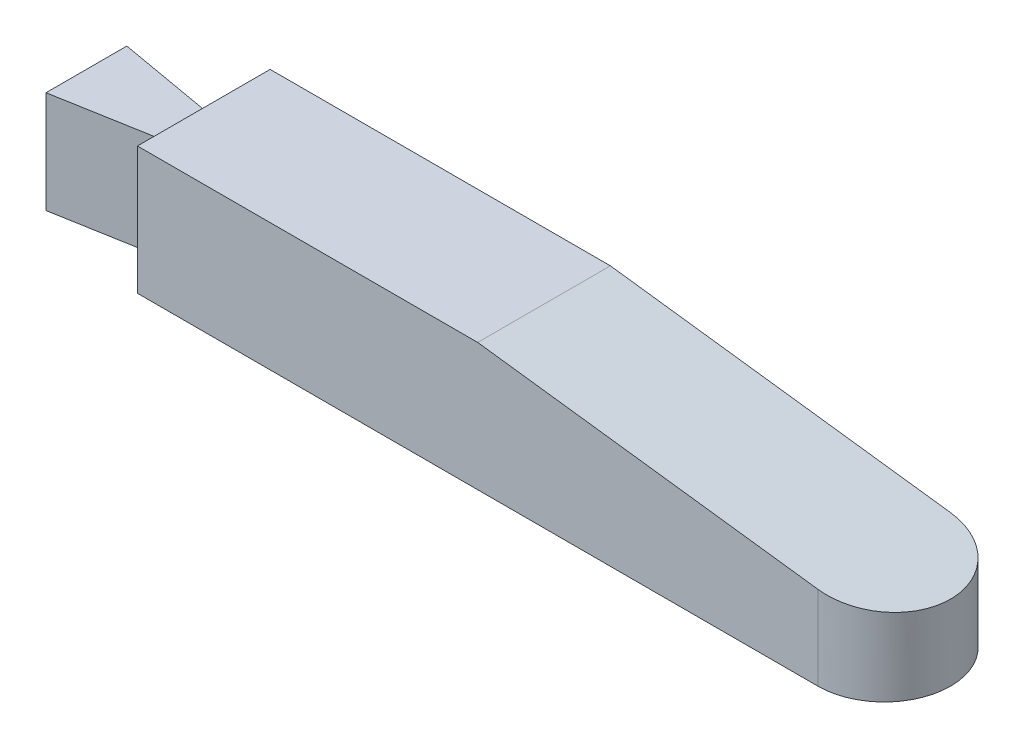
from build123d import *

# Parameters (mm, degrees)
BOSS_EXTRUDE1_DEPTH = 38.1
CUT_EXTRUDE1_DEPTH  = 7.62
CUT_EXTRUDE4_DEPTH  = 39.624


with BuildPart() as part:
    # Sketch2 → Boss-Extrude1 (new body)
    with BuildSketch(Plane(origin=(0, 0, 0), x_dir=(1, 0, 0), z_dir=(0, 1, 0))):
        with BuildLine():
            Line((-13.549240888, -8.64489), (-13.549240888, -32.77489))
            Line((-13.549240888, -32.77489), (21.502759112, -26.594276672))
            Line((21.502759112, -26.594276672), (21.502759112, -40.52189))
            Line((21.502759112, -40.52189), (224.702759112, -40.52189))
            ThreePointArc((224.702759112, -40.52189), (244.514759112, -20.70989), (224.702759112, -0.89789))
            Line((224.702759112, -0.89789), (21.502759112, -0.89789))
            Line((21.502759112, -0.89789), (21.502759112, -14.825503328))
            Line((21.502759112, -14.825503328), (-13.549240888, -8.64489))
        make_face()
    extrude(amount=BOSS_EXTRUDE1_DEPTH)

    # Sketch3 → Cut-Extrude1 (cut)
    with BuildSketch(Plane(origin=(0, 38.1, 0), x_dir=(1, 0, 0), z_dir=(0, 1, 0))):
        Polygon((-13.549240888, -8.64489), (-13.549240888, -32.77489), (21.502759112, -26.594276672), (21.502759112, -14.825503328), align=None)
    extrude(amount=-CUT_EXTRUDE1_DEPTH, mode=Mode.SUBTRACT)

    # Sketch5 → Cut-Extrude4 (cut)
    with BuildSketch(Plane.XY.offset(40.52189)):
        Polygon((123.102759112, 38.1), (244.514759112, 22.519655205), (244.514759112, 38.1), align=None)
    extrude(amount=-CUT_EXTRUDE4_DEPTH, mode=Mode.SUBTRACT)


solid = part.part
